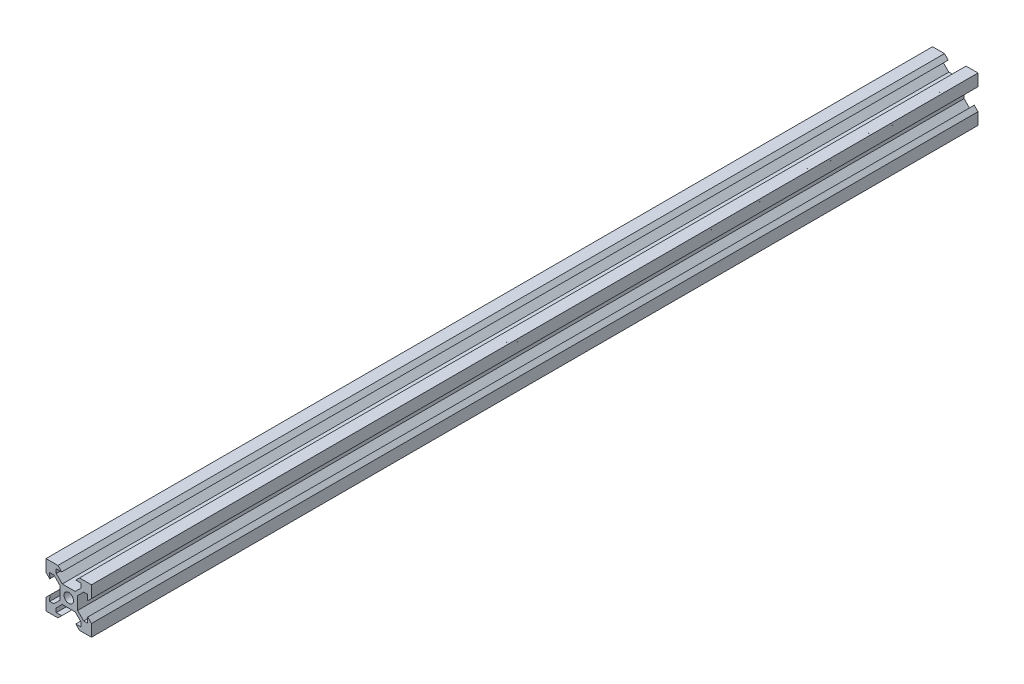
from build123d import *

# Parameters (mm, degrees)
SKETCH1_R           = 2.1
BOSS_EXTRUDE1_DEPTH = 390


with BuildPart() as part:
    # Sketch1 → Boss-Extrude1 (new body)
    with BuildSketch(Plane.XY):
        Polygon((2.834320347, 3.893970342), (5.5, 6.558849663), (5.5, 8.349069506), (3.1, 8.349069506), (4.75, 9.998574117), (10, 9.998574117), (10, 4.746997406), (8.35, 3.097492795), (8.350720674, 5.497492687), (6.560500912, 5.498030255), (3.894821259, 2.833150935), (3.894821259, -2.833150935), (6.560500912, -5.498030255), (8.350720674, -5.497492687), (8.35, -3.097492795), (10, -4.746997406), (10, -9.998574117), (4.75, -9.998574117), (3.1, -8.349069506), (5.5, -8.349069506), (5.5, -6.558849663), (2.834320347, -3.893970342), (-2.834320347, -3.893970342), (-5.5, -6.558849663), (-5.5, -8.349069506), (-3.1, -8.349069506), (-4.75, -9.998574117), (-10, -9.998574117), (-10, -4.746997406), (-8.35, -3.097492795), (-8.350720674, -5.497492687), (-6.560500912, -5.498030255), (-3.894821259, -2.833150935), (-3.894821259, 2.833150935), (-6.560500912, 5.498030255), (-8.350720674, 5.497492687), (-8.35, 3.097492795), (-10, 4.746997406), (-10, 9.998574117), (-4.75, 9.998574117), (-3.1, 8.349069506), (-5.5, 8.349069506), (-5.5, 6.558849663), (-2.834320347, 3.893970342), align=None)
        Circle(SKETCH1_R, mode=Mode.SUBTRACT)
    extrude(amount=BOSS_EXTRUDE1_DEPTH)


solid = part.part
